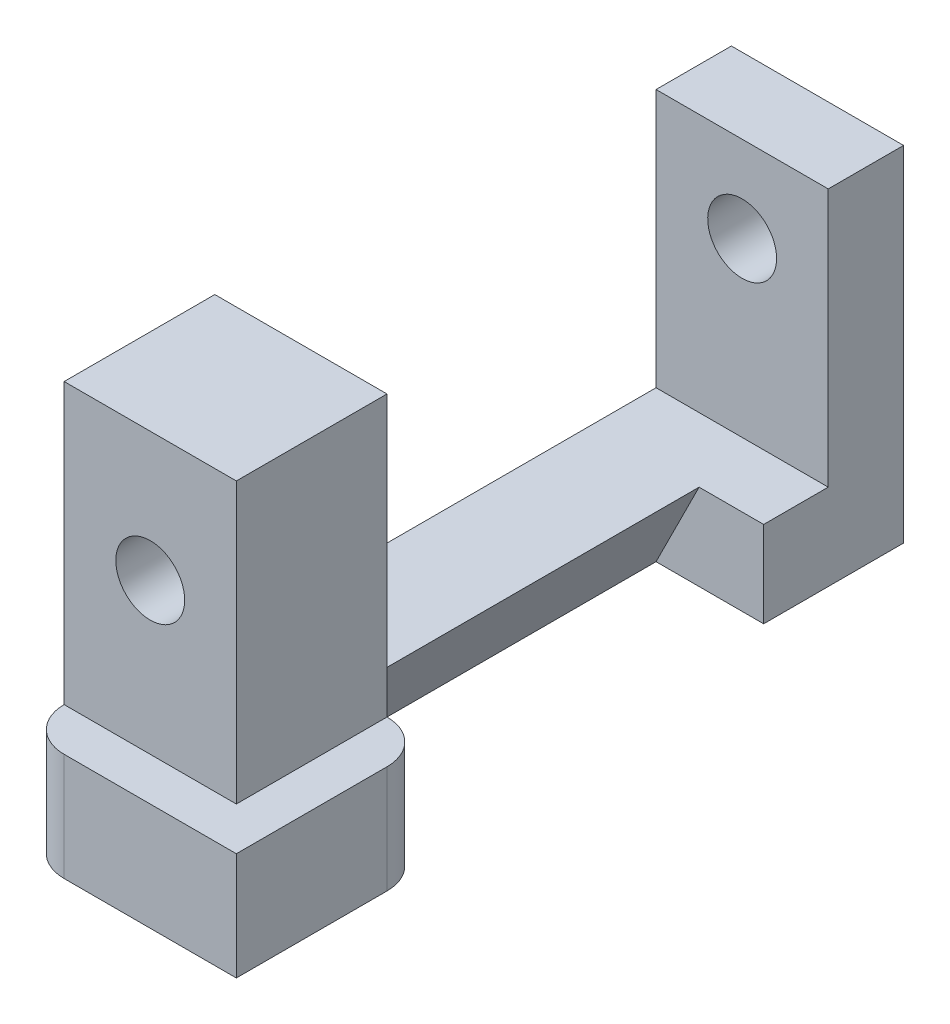
from build123d import *

# Parameters (mm, degrees)
BOSS_EXTRUDE1_DEPTH       = 8
CUT_EXTRUDE2_DEPTH        = 20.5
SKETCH6_W                 = 35.270415117
SKETCH6_H                 = 22.226622545
CUT_EXTRUDE3_DEPTH        = 8
BOSS_EXTRUDE2_DEPTH       = 3
BOSS_EXTRUDE7_DEPTH       = 5
SKETCH7_R                 = 1.6
CUT_EXTRUDE6_DEPTH        = 40.255572853
F_3_0MM_DOWEL_HOLE1_D     = 3
F_3_0MM_DOWEL_HOLE1_DEPTH = 5
F_3_0MM_DOWEL_HOLE1_TIP   = 0.901290929


with BuildPart() as part:
    # Sketch1 → Boss-Extrude1 (new body)
    with BuildSketch(Plane(origin=(0, 0, 0), x_dir=(0, 0, -1), z_dir=(1, 0, 0))):
        Polygon((0, 0), (0, 16), (-3.5, 16), (-3.5, 4), (-24, 4), (-24, 18), (-31, 18), (-31, 0), align=None)
    boss_extrude1 = extrude(amount=-BOSS_EXTRUDE1_DEPTH)

    # Sketch5 → Cut-Extrude2 (cut)
    with BuildSketch(Plane.XY.offset(3.5)):
        Polygon((-8, 0), (-3, 0), (-5, 4), (-8, 4), align=None)
    cut_extrude2 = extrude(amount=CUT_EXTRUDE2_DEPTH, mode=Mode.SUBTRACT)

    # Mirror1: Boss-Extrude1, Cut-Extrude2 across plane
    add(boss_extrude1.mirror(Plane(origin=(-8, 0, 0), x_dir=(0, 0, 1), z_dir=(1, 0, 0))))
    add(cut_extrude2.mirror(Plane(origin=(-8, 0, 0), x_dir=(0, 0, 1), z_dir=(1, 0, 0))), mode=Mode.SUBTRACT)

    # Sketch6 → Cut-Extrude3 (cut)
    with BuildSketch(Plane(origin=(0, 0, 0), x_dir=(0, 0, -1), z_dir=(1, 0, 0))):
        with Locations((-16.260875851, 8.713036563)):
            Rectangle(SKETCH6_W, SKETCH6_H)
    extrude(amount=-CUT_EXTRUDE3_DEPTH, mode=Mode.SUBTRACT)

    # Sketch9 → Boss-Extrude2 (add)
    with BuildSketch(Plane.XY.offset(3.5)):
        Polygon((-11, 4), (-13, 0), (-8, 0), (-8, 4), align=None)
    extrude(amount=BOSS_EXTRUDE2_DEPTH)

    # Sketch13 → Boss-Extrude7 (add)
    with BuildSketch(Plane.XZ):
        with BuildLine():
            Line((-14, 33), (-6, 33))
            Line((-6, 33), (-6, 26))
            ThreePointArc((-6, 26), (-6.585786438, 24.585786438), (-8, 24))
            Line((-8, 24), (-8, 31))
            Line((-8, 31), (-16, 31))
            ThreePointArc((-16, 31), (-15.414213562, 32.414213562), (-14, 33))
        make_face()
    extrude(amount=-BOSS_EXTRUDE7_DEPTH)

    # Sketch7 → Cut-Extrude6 (cut, through all)
    with BuildSketch(Plane.XY.offset(31)):
        with Locations((-12, 12)):
            Circle(SKETCH7_R)
    extrude(amount=-CUT_EXTRUDE6_DEPTH, mode=Mode.SUBTRACT)

    # Ø3.0mm Dowel Hole1
    with Locations(Plane(origin=(0, 0, 0), x_dir=(-1, 0, 0), z_dir=(0, -1, 0))):
        with Locations((10.285, -29)):
            Hole(F_3_0MM_DOWEL_HOLE1_D / 2, depth=F_3_0MM_DOWEL_HOLE1_DEPTH)
            with Locations((0, 0, -(F_3_0MM_DOWEL_HOLE1_DEPTH + F_3_0MM_DOWEL_HOLE1_TIP / 2))):  # 118° drill point
                Cone(0, F_3_0MM_DOWEL_HOLE1_D / 2, F_3_0MM_DOWEL_HOLE1_TIP, mode=Mode.SUBTRACT)


solid = part.part
